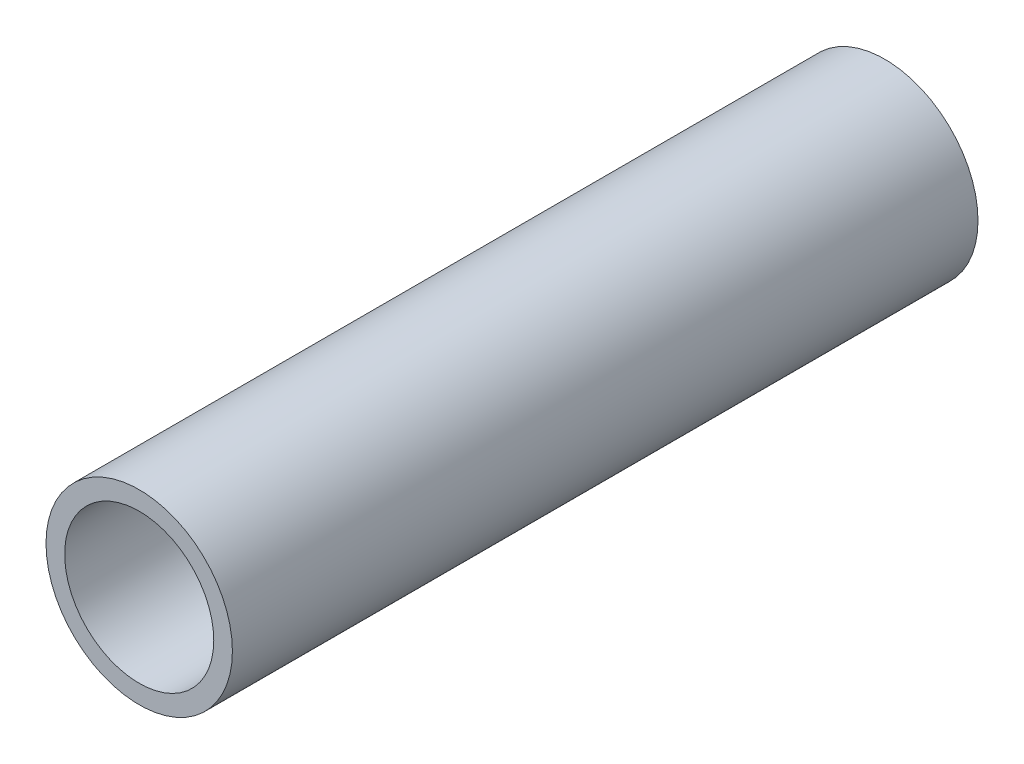
from build123d import *

# Parameters (mm, degrees)
SKETCH1_R           = 12.5
SKETCH1_R_2         = 10
BOSS_EXTRUDE1_DEPTH = 100


with BuildPart() as part:
    # Sketch1 → Boss-Extrude1 (new body)
    with BuildSketch(Plane.XY):
        Circle(SKETCH1_R)
        Circle(SKETCH1_R_2, mode=Mode.SUBTRACT)
    extrude(amount=-BOSS_EXTRUDE1_DEPTH)


solid = part.part
